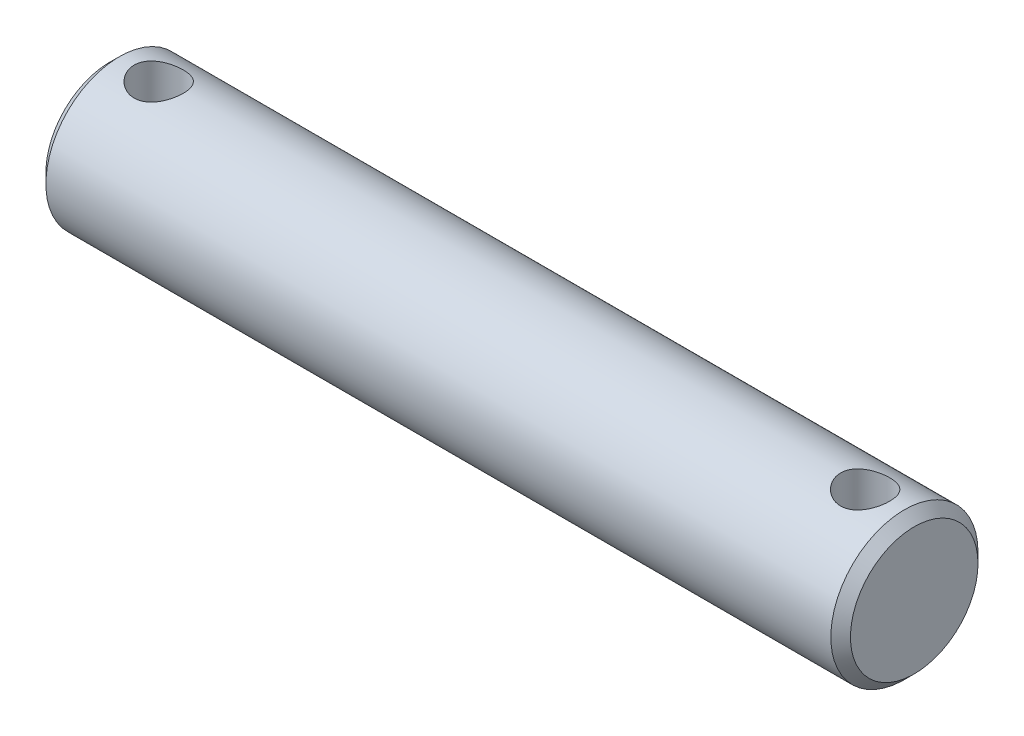
from build123d import *

# Parameters (mm, degrees)
DODANIE_WYCI_GNI_CIE1_DEPTH            = 41
DODANIE_WYCI_GNI_CIE1_DEPTH_BACK       = 41
SZKIC2_R                               = 7.5
WYTNIJ_WYCI_GNI_CIE1_REACH             = 44.35
SZKIC3_R                               = 2.5
WYTNIJ_WYCI_GNI_CIE1_DIRECTION_2_REACH = 44.35
SFAZOWANIE1_SIZE                       = 1


with BuildPart() as part:
    # Szkic2 → Dodanie-wyciągnięcie1 (new, two sides: drawn at the far end of the back side and taken through both)
    with BuildSketch(Plane(origin=(0, 0, 0), x_dir=(0, 0, -1), z_dir=(1, 0, 0)).offset(-DODANIE_WYCI_GNI_CIE1_DEPTH_BACK)):
        Circle(SZKIC2_R)
    extrude(amount=DODANIE_WYCI_GNI_CIE1_DEPTH + DODANIE_WYCI_GNI_CIE1_DEPTH_BACK)

    # Szkic3 → Wytnij-wyciągnięcie1 (cut, up to next)
    with BuildSketch(Plane(origin=(0, 0, 0), x_dir=(1, 0, 0), z_dir=(0, 1, 0)), mode=Mode.PRIVATE) as wytnij_wyci_gni_cie1_sk1:
        with Locations((-36, 0)):
            Circle(SZKIC3_R)
    wytnij_wyci_gni_cie1_tool1 = extrude(wytnij_wyci_gni_cie1_sk1.sketch, amount=-WYTNIJ_WYCI_GNI_CIE1_REACH, mode=Mode.PRIVATE) & part.part
    # Szkic3 → Wytnij-wyciągnięcie1 (cut, up to next)
    with BuildSketch(Plane(origin=(0, 0, 0), x_dir=(1, 0, 0), z_dir=(0, 1, 0)), mode=Mode.PRIVATE) as wytnij_wyci_gni_cie1_sk2:
        with Locations((36, 0)):
            Circle(SZKIC3_R)
    wytnij_wyci_gni_cie1_tool2 = extrude(wytnij_wyci_gni_cie1_sk2.sketch, amount=-WYTNIJ_WYCI_GNI_CIE1_REACH, mode=Mode.PRIVATE) & part.part
    add(wytnij_wyci_gni_cie1_tool1.solids().sort_by_distance((-36, 0, 0))[0], mode=Mode.SUBTRACT)
    add(wytnij_wyci_gni_cie1_tool2.solids().sort_by_distance((36, 0, 0))[0], mode=Mode.SUBTRACT)

    # Szkic3 → Wytnij-wyciągnięcie1 direction 2 (cut, up to next)
    with BuildSketch(Plane(origin=(0, 0, 0), x_dir=(1, 0, 0), z_dir=(0, 1, 0)), mode=Mode.PRIVATE) as wytnij_wyci_gni_cie1_direction_2_sk1:
        with Locations((-36, 0)):
            Circle(SZKIC3_R)
    wytnij_wyci_gni_cie1_direction_2_tool1 = extrude(wytnij_wyci_gni_cie1_direction_2_sk1.sketch, amount=WYTNIJ_WYCI_GNI_CIE1_DIRECTION_2_REACH, mode=Mode.PRIVATE) & part.part
    # Szkic3 → Wytnij-wyciągnięcie1 direction 2 (cut, up to next)
    with BuildSketch(Plane(origin=(0, 0, 0), x_dir=(1, 0, 0), z_dir=(0, 1, 0)), mode=Mode.PRIVATE) as wytnij_wyci_gni_cie1_direction_2_sk2:
        with Locations((36, 0)):
            Circle(SZKIC3_R)
    wytnij_wyci_gni_cie1_direction_2_tool2 = extrude(wytnij_wyci_gni_cie1_direction_2_sk2.sketch, amount=WYTNIJ_WYCI_GNI_CIE1_DIRECTION_2_REACH, mode=Mode.PRIVATE) & part.part
    add(wytnij_wyci_gni_cie1_direction_2_tool1.solids().sort_by_distance((-36, 0, 0))[0], mode=Mode.SUBTRACT)
    add(wytnij_wyci_gni_cie1_direction_2_tool2.solids().sort_by_distance((36, 0, 0))[0], mode=Mode.SUBTRACT)

    # Sfazowanie1
    sfazowanie1_edges = [part.edges().sort_by_distance(p)[0] for p in [
        (-41, 0, 7.5),
        (41, 0, 7.5),
    ]]
    chamfer(sfazowanie1_edges, length=SFAZOWANIE1_SIZE)


solid = part.part
